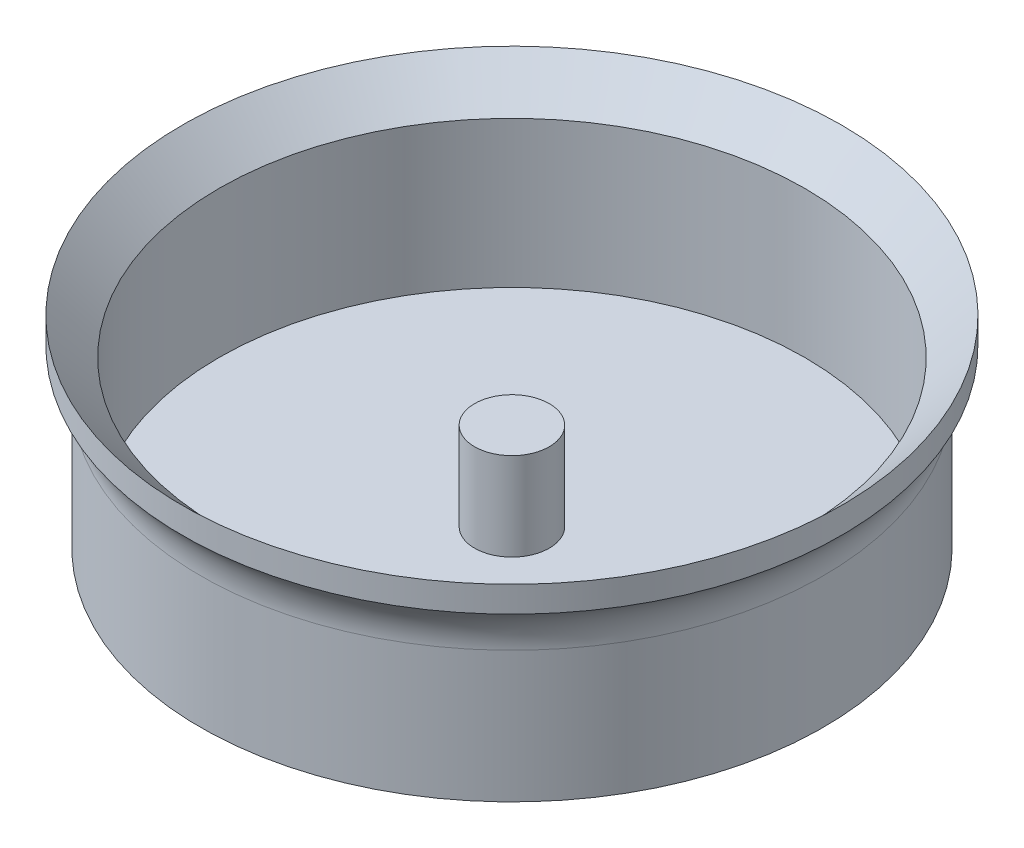
from build123d import *


with BuildPart() as part:
    # Sketch2 → Revolve1 (revolve)
    with BuildSketch(Plane(origin=(0, 0, 0), x_dir=(0, 0, -1), z_dir=(1, 0, 0))):
        with BuildLine():
            Line((0, 0), (0, 9.2075))
            Line((0, 9.2075), (3.2385, 9.2075))
            Line((3.2385, 9.2075), (3.2385, 1.5875))
            Line((3.2385, 1.5875), (25.4, 1.5875))
            Line((25.4, 1.5875), (25.4, 14.2875))
            Line((25.4, 14.2875), (28.575, 17.4625))
            Line((28.575, 17.4625), (28.575, 15.21743597))
            ThreePointArc((28.575, 15.21743597), (27.400077808, 13.459040646), (26.9875, 11.384871939))
            Line((26.9875, 11.384871939), (26.9875, 0))
            Line((26.9875, 0), (0, 0))
        make_face()
    revolve(axis=Axis((0, 0, 0), (0, 1, 0)))


solid = part.part
